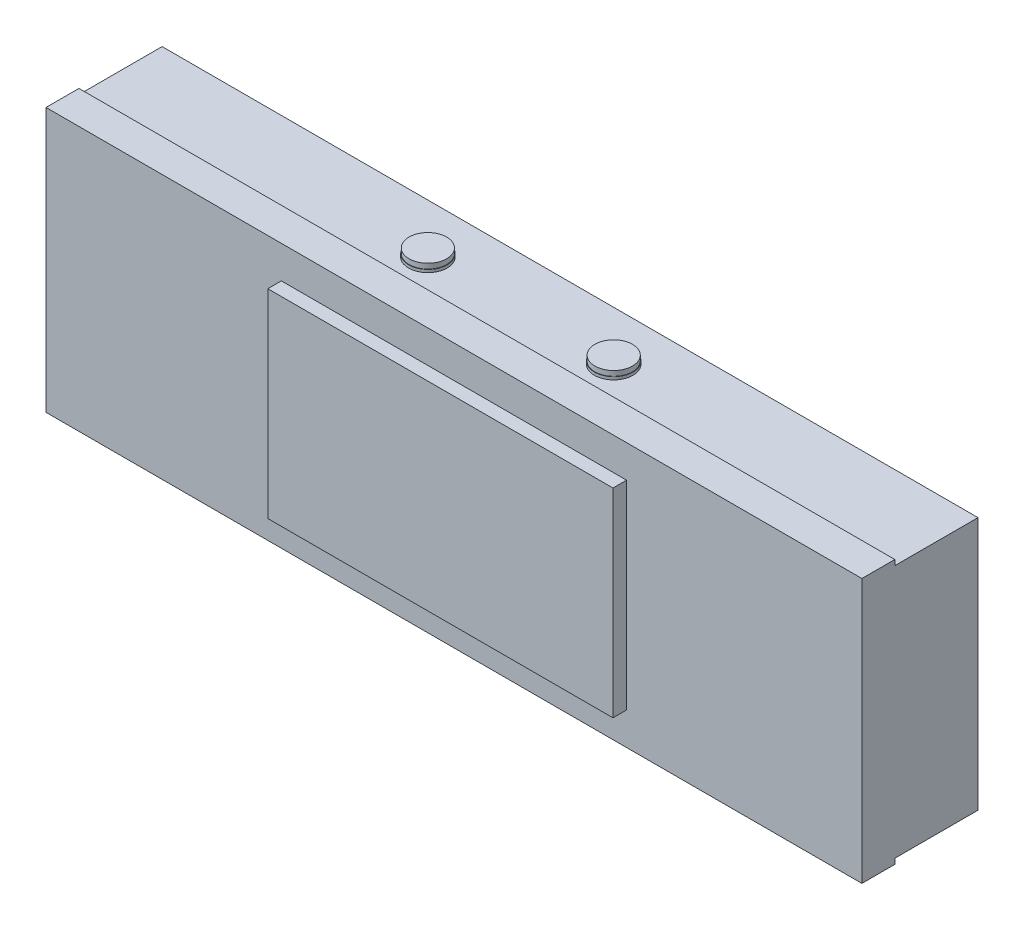
from build123d import *

# Parameters (mm, degrees)
LID_SKETCH_W                       = 10.5
LID_SKETCH_H                       = 84.15
LID_DEPTH                          = 130
CHANNEL_WALL_SKETCH_W              = 26.5
CHANNEL_WALL_SKETCH_H              = 80.75
CHANNEL_WALL_DEPTH                 = 130
HANGER_PLATE_AND_HARDWARE_SKETCH_W = 110
HANGER_PLATE_AND_HARDWARE_SKETCH_H = 63.43
HANGER_PLATE_AND_HARDWARE_DEPTH    = 2.16
INSERT_FLANGES_Y_SKETCH_R          = 6.15
INSERT_FLANGES_Y_DEPTH             = 0.945
INSERT_FLANGES_Y_SKETCH_2_R        = 6.15
INSERT_FLANGES_Y_2_DEPTH           = 0.945
SPACER_WASHERS_Y_SKETCH_R          = 6
SPACER_WASHERS_Y_DEPTH             = 0.8
SPACER_WASHERS_Y_SKETCH_2_R        = 6
SPACER_WASHERS_Y_2_DEPTH           = 0.8


with BuildPart() as part:
    # lid sketch → lid (new, symmetric)
    with BuildSketch(Plane(origin=(0, 0, 0), x_dir=(0, 0, -1), z_dir=(1, 0, 0))):
        with Locations((5.25, 0)):
            Rectangle(LID_SKETCH_W, LID_SKETCH_H)
    extrude(amount=LID_DEPTH, both=True)

    # channel wall sketch → channel wall (add, symmetric)
    with BuildSketch(Plane(origin=(0, 0, 0), x_dir=(0, 0, -1), z_dir=(1, 0, 0))):
        with Locations((23.75, 0)):
            Rectangle(CHANNEL_WALL_SKETCH_W, CHANNEL_WALL_SKETCH_H)
    extrude(amount=CHANNEL_WALL_DEPTH, both=True)

    # hanger plate and hardware sketch → hanger plate and hardware (add, symmetric)
    with BuildSketch(Plane.XY.offset(2.16)):
        Rectangle(HANGER_PLATE_AND_HARDWARE_SKETCH_W, HANGER_PLATE_AND_HARDWARE_SKETCH_H)
    extrude(amount=HANGER_PLATE_AND_HARDWARE_DEPTH, both=True)

    # insert flanges _y sketch → insert flanges _y (add, symmetric)
    with BuildSketch(Plane(origin=(0, 40.32, 0), x_dir=(1, 0, 0), z_dir=(0, 1, 0))):
        with Locations(Location((29.605, 21.3, 0), (0, 0, 90))):
            Circle(INSERT_FLANGES_Y_SKETCH_R)
        with Locations(Location((-29.605, 21.3, 0), (0, 0, 90))):
            Circle(INSERT_FLANGES_Y_SKETCH_R)
    extrude(amount=INSERT_FLANGES_Y_DEPTH, both=True)

    # insert flanges -y sketch 2 → insert flanges -y 2 (add, symmetric)
    with BuildSketch(Plane(origin=(0, -40.32, 0), x_dir=(1, 0, 0), z_dir=(0, 1, 0))):
        with Locations(Location((29.605, 21.3, 0), (0, 0, 90))):
            Circle(INSERT_FLANGES_Y_SKETCH_2_R)
        with Locations(Location((-29.605, 21.3, 0), (0, 0, 90))):
            Circle(INSERT_FLANGES_Y_SKETCH_2_R)
    extrude(amount=INSERT_FLANGES_Y_2_DEPTH, both=True)

    # spacer washers _y sketch → spacer washers _y (add, symmetric)
    with BuildSketch(Plane(origin=(0, 42.065, 0), x_dir=(1, 0, 0), z_dir=(0, 1, 0))):
        with Locations(Location((29.605, 21.3, 0), (0, 0, 270))):
            Circle(SPACER_WASHERS_Y_SKETCH_R)
        with Locations(Location((-29.605, 21.3, 0), (0, 0, 270))):
            Circle(SPACER_WASHERS_Y_SKETCH_R)
    extrude(amount=SPACER_WASHERS_Y_DEPTH, both=True)

    # spacer washers -y sketch 2 → spacer washers -y 2 (add, symmetric)
    with BuildSketch(Plane(origin=(0, -42.065, 0), x_dir=(1, 0, 0), z_dir=(0, 1, 0))):
        with Locations(Location((29.605, 21.3, 0), (0, 0, 270))):
            Circle(SPACER_WASHERS_Y_SKETCH_2_R)
        with Locations(Location((-29.605, 21.3, 0), (0, 0, 270))):
            Circle(SPACER_WASHERS_Y_SKETCH_2_R)
    extrude(amount=SPACER_WASHERS_Y_2_DEPTH, both=True)


solid = part.part
